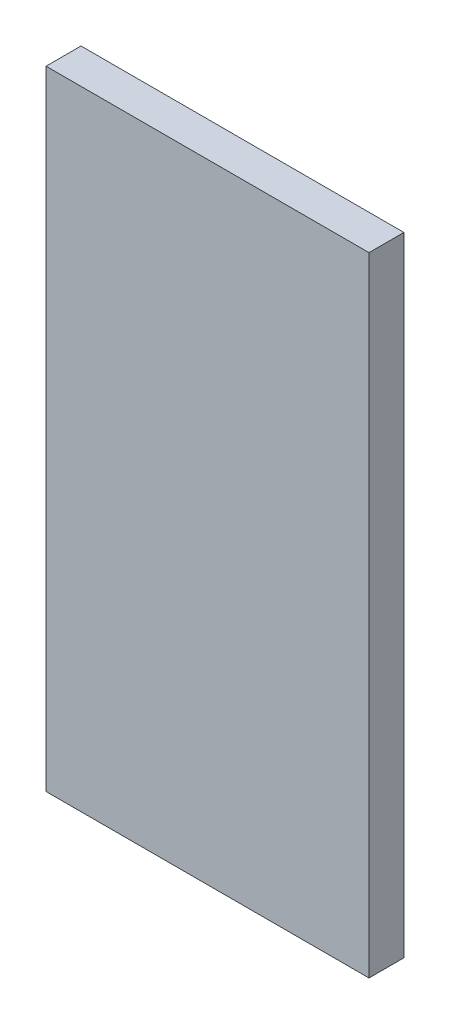
from build123d import *

# Parameters (mm, degrees)
SKETCH1_W           = 73
SKETCH1_H           = 142
BOSS_EXTRUDE1_DEPTH = 7.9


with BuildPart() as part:
    # Sketch1 → Boss-Extrude1 (new body)
    with BuildSketch(Plane.XY):
        with Locations((36.5, 71)):
            Rectangle(SKETCH1_W, SKETCH1_H)
    extrude(amount=BOSS_EXTRUDE1_DEPTH)


solid = part.part
